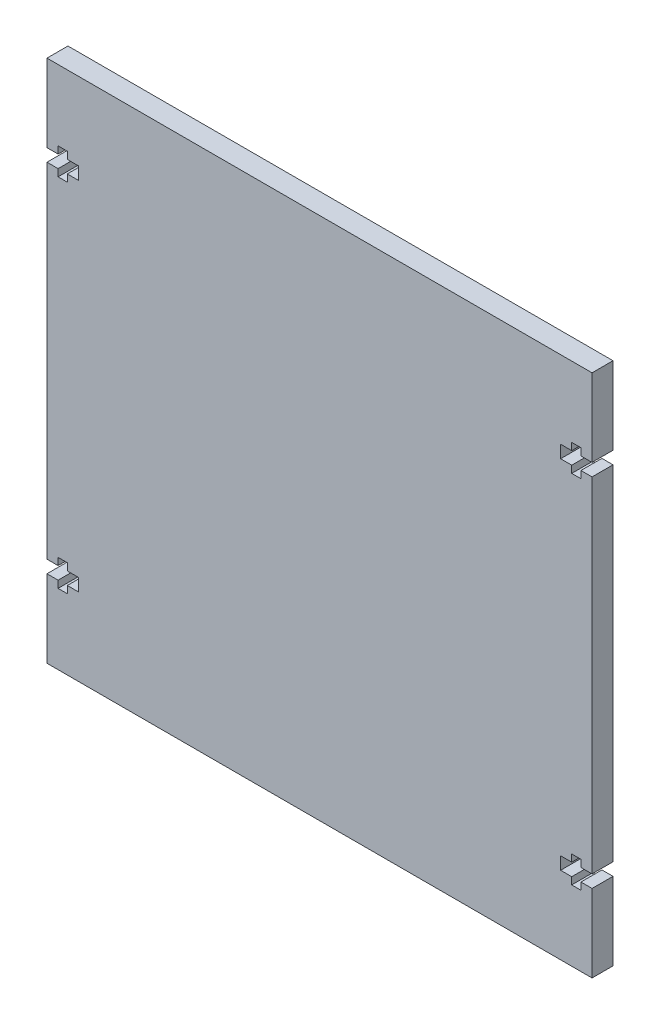
from build123d import *

# Parameters (mm, degrees)
SKETCH1_W            = 165.1
SKETCH1_H            = 158.75
BOSS_EXTRUDE2_DEPTH  = 6.35
CUT_EXTRUDE1_DEPTH   = 115.696188363
MIRROR2_COPY_1_DEPTH = 115.696188363


with BuildPart() as part:
    # Sketch1 → Boss-Extrude2 (new body)
    with BuildSketch(Plane.XY):
        Rectangle(SKETCH1_W, SKETCH1_H)
    extrude(amount=BOSS_EXTRUDE2_DEPTH)

    # Sketch2 → Cut-Extrude1 (cut, through all)
    with BuildSketch(Plane.XY.offset(6.35)):
        Polygon((82.55, 55.88), (79.1845, 55.88), (79.1845, 58.039), (76.3905, 58.039), (76.3905, 55.88), (73.025, 55.88), (73.025, 52.07), (76.3905, 52.07), (76.3905, 49.911), (79.1845, 49.911), (79.1845, 52.07), (82.55, 52.07), align=None)
    cut_extrude1 = extrude(amount=-CUT_EXTRUDE1_DEPTH, mode=Mode.SUBTRACT)

    # Mirror1: Cut-Extrude1 across plane
    add(cut_extrude1.mirror(Plane.ZX), mode=Mode.SUBTRACT)

    # Mirror2: Cut-Extrude1 across plane
    add(cut_extrude1.mirror(Plane(origin=(0, 0, 0), x_dir=(0, 0, 1), z_dir=(1, 0, 0))), mode=Mode.SUBTRACT)

    # Mirror2 copy 1 sketch → Mirror2 copy 1 (cut, through all)
    with BuildSketch(Plane(origin=(0, 0, 6.35), x_dir=(-1, 0, 0), z_dir=(0, 0, 1))):
        Polygon((82.55, 55.88), (79.1845, 55.88), (79.1845, 58.039), (76.3905, 58.039), (76.3905, 55.88), (73.025, 55.88), (73.025, 52.07), (76.3905, 52.07), (76.3905, 49.911), (79.1845, 49.911), (79.1845, 52.07), (82.55, 52.07), align=None)
    extrude(amount=-MIRROR2_COPY_1_DEPTH, mode=Mode.SUBTRACT)


solid = part.part
